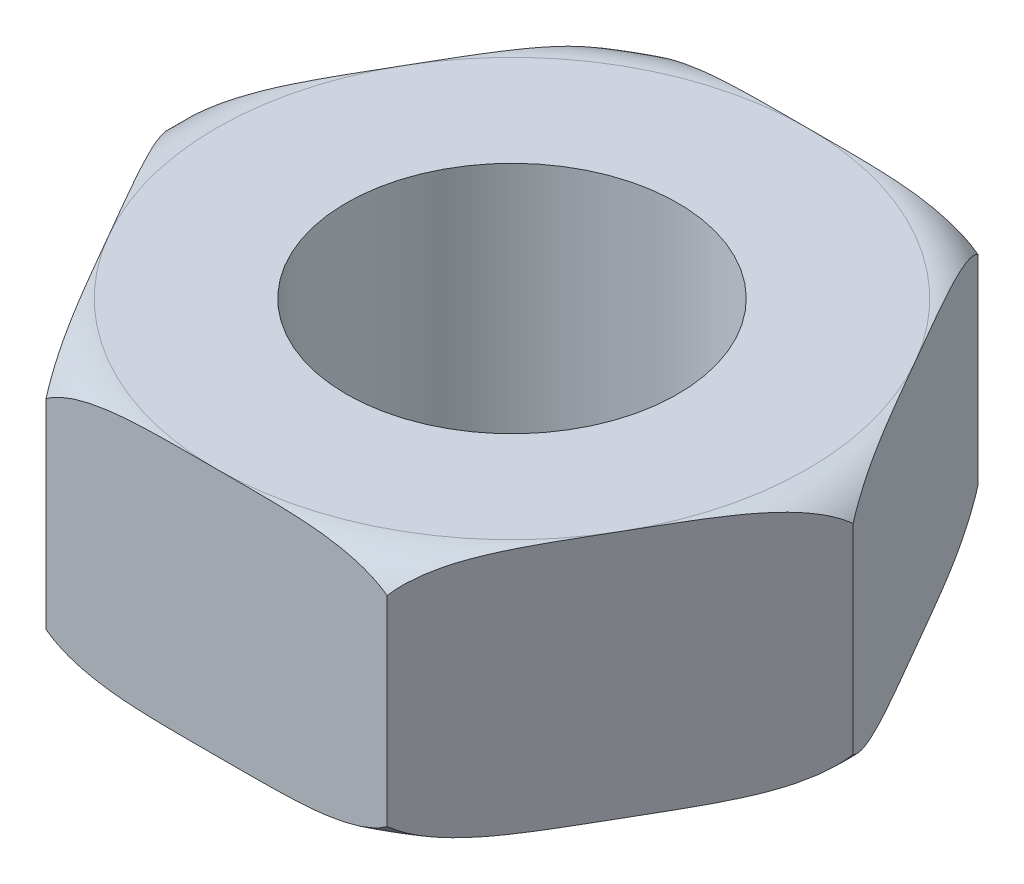
from build123d import *

# Parameters (mm, degrees)
SKETCH1_R           = 1.5
BOSS_EXTRUDE1_DEPTH = 2.25


with BuildPart() as part:
    # Sketch1 → Boss-Extrude1 (new body)
    with BuildSketch(Plane(origin=(0, 0, 0), x_dir=(1, 0, 0), z_dir=(0, 1, 0))):
        Polygon((1.54441197, 2.675), (-1.54441197, 2.675), (-3.08882394, 0), (-1.54441197, -2.675), (1.54441197, -2.675), (3.08882394, 0), align=None)
        with Locations(Location((0, 0, 0), (0, 0, 270))):
            Circle(SKETCH1_R, mode=Mode.SUBTRACT)
    extrude(amount=BOSS_EXTRUDE1_DEPTH)

    # Sketch2 → Cut-Revolve1 (revolve, cut)
    with BuildSketch(Plane(origin=(0, 0, 0), x_dir=(0, 0, -1), z_dir=(1, 0, 0))):
        with BuildLine():
            Line((0, 2.25), (-2.675, 2.25))
            ThreePointArc((-2.675, 2.25), (-3.012170516, 2.119210025), (-3.17294694, 1.795264171))
            Line((-3.17294694, 1.795264171), (-3.317266919, 1.795264171))
            Line((-3.317266919, 1.795264171), (-3.317266919, 2.57459206))
            Line((-3.317266919, 2.57459206), (0, 2.57459206))
            Line((0, 2.57459206), (0, 2.25))
        make_face()
        with BuildLine():
            Line((0, -0.32459206), (0, 0))
            Line((0, 0), (-2.675, 0))
            ThreePointArc((-2.675, 0), (-3.012170516, 0.130789975), (-3.17294694, 0.454735829))
            Line((-3.17294694, 0.454735829), (-3.317266919, 0.454735829))
            Line((-3.317266919, 0.454735829), (-3.317266919, -0.32459206))
            Line((-3.317266919, -0.32459206), (0, -0.32459206))
        make_face()
    revolve(axis=Axis((0, 2.25, 0), (0, -1, 0)), mode=Mode.SUBTRACT)


solid = part.part
